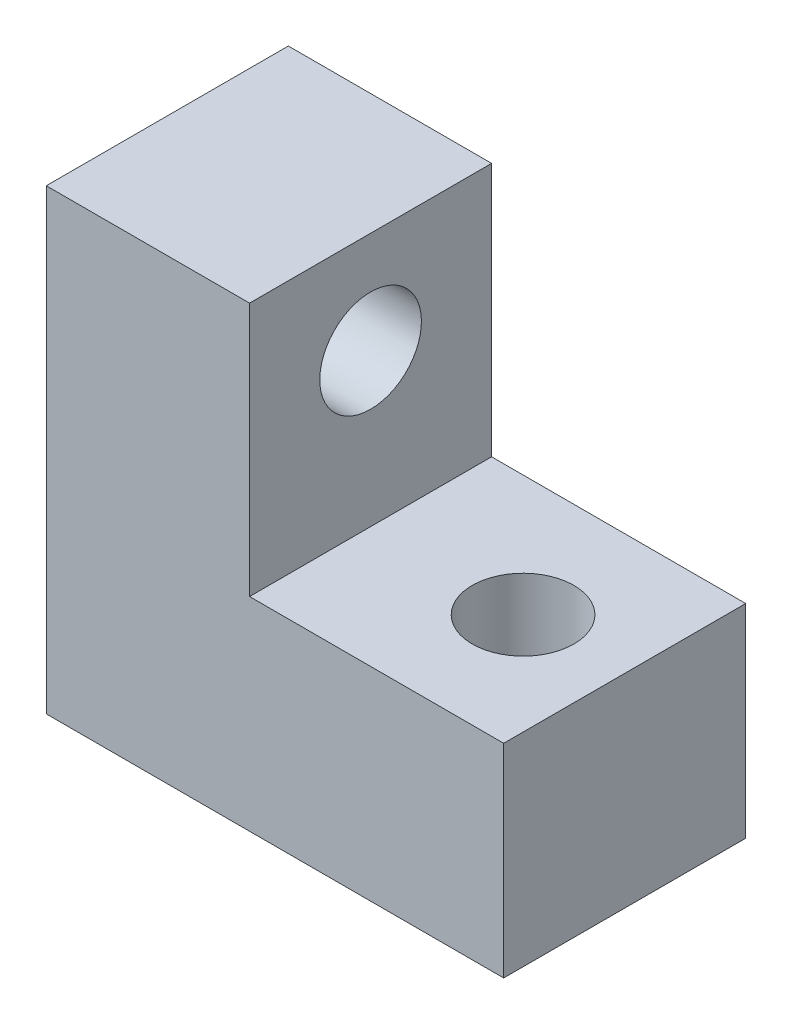
from build123d import *

# Parameters (mm, degrees)
EXTRUDE_3_8_DEPTH = 9.525
SKETCH2_R         = 2
M4_DRILL_DEPTH    = 8
SKETCH3_R         = 2
M4_DRILL2_DEPTH   = 8


with BuildPart() as part:
    # Sketch1 → 3/8 (new body)
    with BuildSketch(Plane.XY):
        Polygon((0, 0), (18, 0), (18, 8), (8, 8), (8, 18), (0, 18), align=None)
    extrude(amount=EXTRUDE_3_8_DEPTH)

    # Sketch2 → M4_DRILL (cut)
    with BuildSketch(Plane.ZY):
        with Locations(Location((4.7625, 14, 0), (0, 0, 270))):
            Circle(SKETCH2_R)
    extrude(amount=-M4_DRILL_DEPTH, mode=Mode.SUBTRACT)

    # Sketch3 → M4_DRILL2 (cut)
    with BuildSketch(Plane(origin=(0, 0, 0), x_dir=(-1, 0, 0), z_dir=(0, -1, 0))):
        with Locations(Location((-14, -4.7625, 0), (0, 0, 180))):
            Circle(SKETCH3_R)
    extrude(amount=-M4_DRILL2_DEPTH, mode=Mode.SUBTRACT)


solid = part.part
